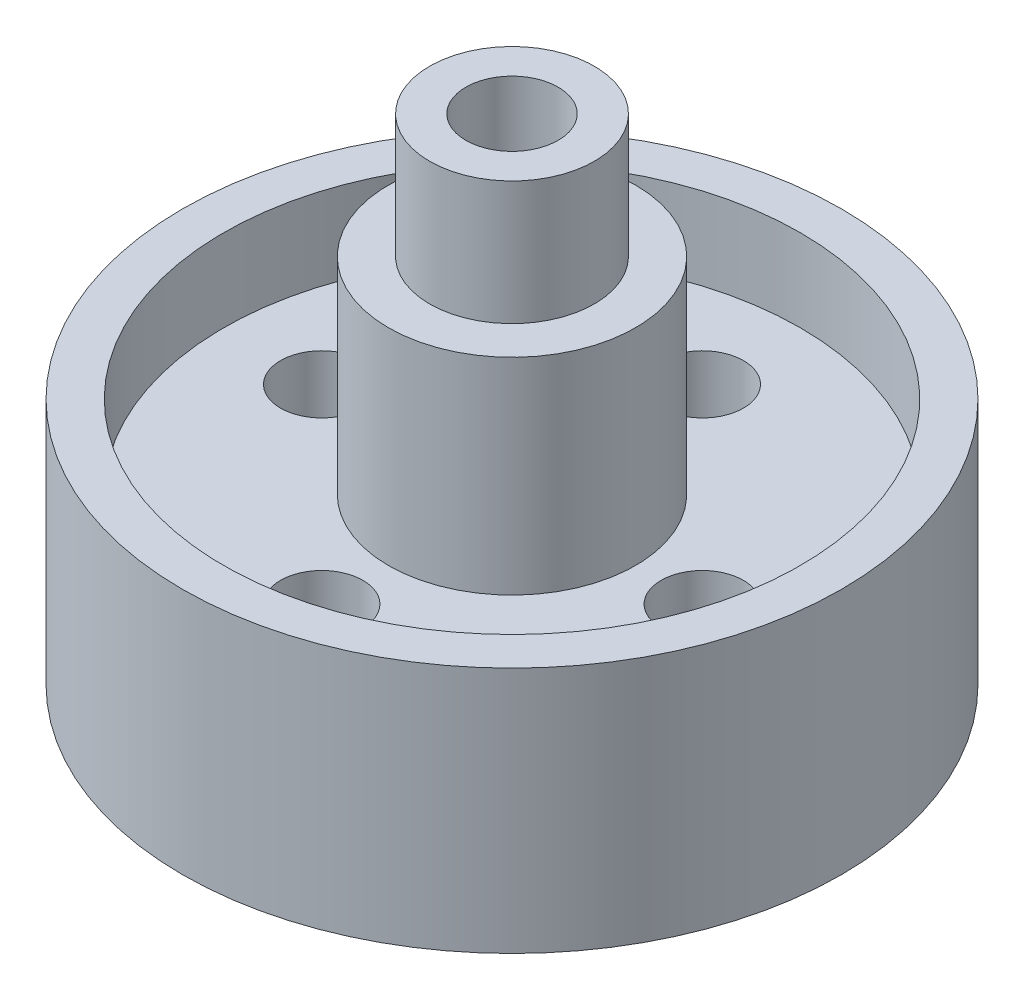
from build123d import *

# Parameters (mm, degrees)
SKETCH1_R           = 50.8
SKETCH1_R_2         = 44.45
BOSS_EXTRUDE1_DEPTH = 38.1
SKETCH1_3_R         = 44.45
SKETCH1_3_R_2       = 19.05
BOSS_EXTRUDE2_DEPTH = 25.4
SKETCH1_5_R         = 19.05
SKETCH1_5_R_2       = 12.7
BOSS_EXTRUDE3_DEPTH = 57.15
SKETCH1_6_R         = 12.7
SKETCH1_6_R_2       = 7.112
BOSS_EXTRUDE4_DEPTH = 76.2
CUT_EXTRUDE5_START  = 25.4
SKETCH2_R           = 6.35
CUT_EXTRUDE5_DEPTH  = 76.2
CIRPATTERN1_COUNT   = 4


with BuildPart() as part:
    # Sketch1 → Boss-Extrude1 (new body)
    with BuildSketch(Plane(origin=(0, 0, 0), x_dir=(1, 0, 0), z_dir=(0, 1, 0))):
        with Locations(Location((0, 0, 0), (0, 0, 90))):
            Circle(SKETCH1_R)
        with Locations(Location((0, 0, 0), (0, 0, 90))):
            Circle(SKETCH1_R_2, mode=Mode.SUBTRACT)
    extrude(amount=BOSS_EXTRUDE1_DEPTH)

    # Sketch1<3> → Boss-Extrude2 (add)
    with BuildSketch(Plane(origin=(0, 0, 0), x_dir=(1, 0, 0), z_dir=(0, 1, 0))):
        with Locations(Location((0, 0, 0), (0, 0, 90))):
            Circle(SKETCH1_3_R)
        with Locations(Location((0, 0, 0), (0, 0, 270))):
            Circle(SKETCH1_3_R_2, mode=Mode.SUBTRACT)
    extrude(amount=BOSS_EXTRUDE2_DEPTH)

    # Sketch1<5> → Boss-Extrude3 (add)
    with BuildSketch(Plane(origin=(0, 0, 0), x_dir=(1, 0, 0), z_dir=(0, 1, 0))):
        with Locations(Location((0, 0, 0), (0, 0, 270))):
            Circle(SKETCH1_5_R)
        with Locations(Location((0, 0, 0), (0, 0, 270))):
            Circle(SKETCH1_5_R_2, mode=Mode.SUBTRACT)
    extrude(amount=BOSS_EXTRUDE3_DEPTH)

    # Sketch1<6> → Boss-Extrude4 (add)
    with BuildSketch(Plane(origin=(0, 0, 0), x_dir=(1, 0, 0), z_dir=(0, 1, 0))):
        with Locations(Location((0, 0, 0), (0, 0, 270))):
            Circle(SKETCH1_6_R)
        with Locations(Location((0, 0, 0), (0, 0, 270))):
            Circle(SKETCH1_6_R_2, mode=Mode.SUBTRACT)
    extrude(amount=BOSS_EXTRUDE4_DEPTH)

    # Sketch2 → Cut-Extrude5 (cut)
    with BuildSketch(Plane(origin=(0, 0, 0), x_dir=(1, 0, 0), z_dir=(0, 1, 0)).offset(CUT_EXTRUDE5_START)):
        with Locations(Location((0, 29.337, 0), (0, 0, 270))):
            Circle(SKETCH2_R)
    cut_extrude5 = extrude(amount=-CUT_EXTRUDE5_DEPTH, mode=Mode.SUBTRACT)

    # CirPattern1: Cut-Extrude5 ×4 about axis
    cirpattern1_axis = Axis((0, 0, 0), (0, 1, 0))
    for i in range(1, CIRPATTERN1_COUNT):
        add(cut_extrude5.rotate(cirpattern1_axis, i * 360 / CIRPATTERN1_COUNT), mode=Mode.SUBTRACT)


solid = part.part
